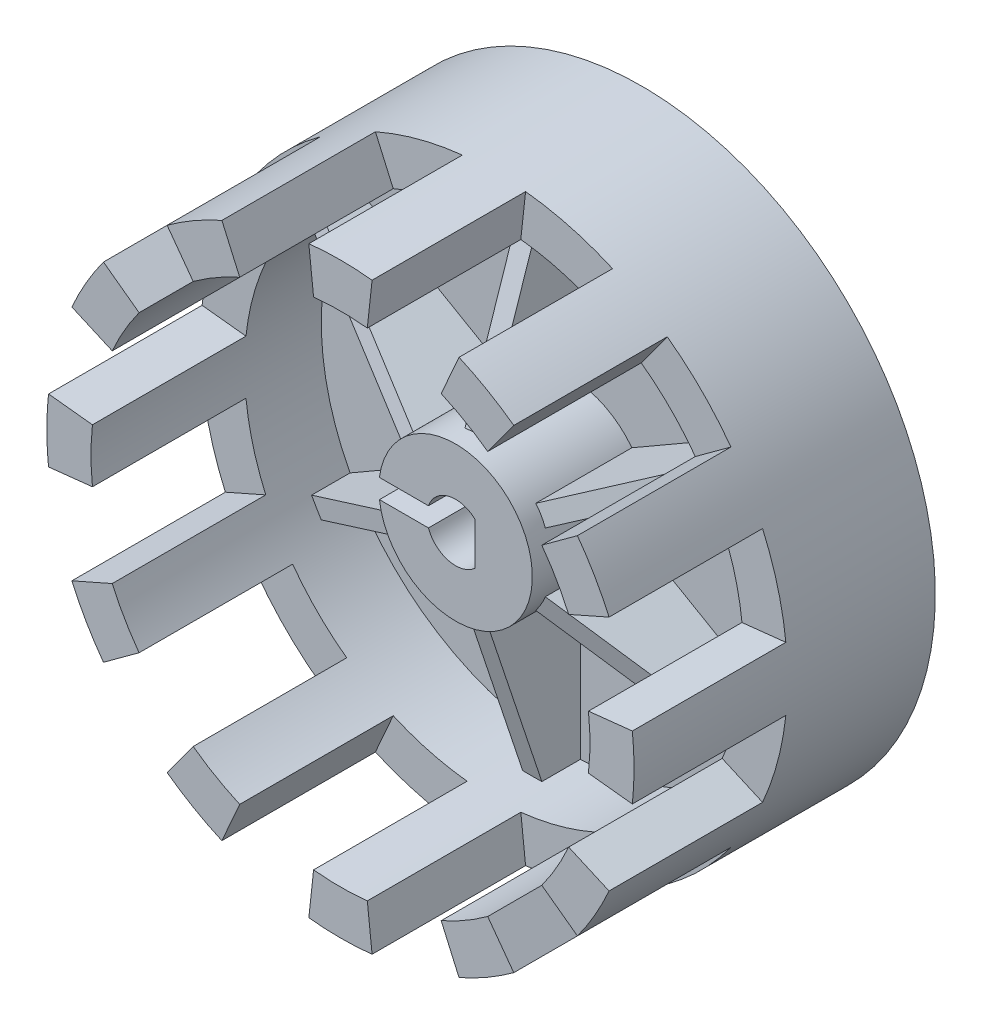
from build123d import *
from build123d.topology import SkipClean

# Parameters (mm, degrees)
ESQUISSE1_R                  = 15.3
BOSS_EXTRU_1_DEPTH           = 3.5
ESQUISSE7_R                  = 15.3
ESQUISSE7_R_2                = 11
ESQUISSE7_R_3                = 3.5
BOSS_EXTRU_10_DEPTH          = 0.2
ESQUISSE2_R                  = 4
BOSS_EXTRU_2_DEPTH           = 6
ENL_V_MAT_EXTRU_2_DEPTH      = 24.631123545
ENL_V_MAT_EXTRU_2_DEPTH_BACK = 24.631123545
ESQUISSE4_R                  = 15.3
ESQUISSE4_R_2                = 13
BOSS_EXTRU_3_DEPTH           = 4
BOSS_EXTRU_4_DEPTH           = 8
R_P_TITION_CIRCULAIRE1_COUNT = 12
BOSS_EXTRU_9_DEPTH           = 0.5
R_P_TITION_CIRCULAIRE4_COUNT = 6


with BuildPart() as part:
    # Esquisse1 → Boss.-Extru.1 (new body)
    with BuildSketch(Plane.XY):
        Circle(ESQUISSE1_R)
    extrude(amount=BOSS_EXTRU_1_DEPTH)

    # Esquisse7 → Boss.-Extru.10 (add, symmetric)
    # profile 1 of 2: a face of its own
    with SkipClean():  # the faces are left unmerged after this step: merging them gives an invalid solid
        with BuildSketch(Plane(origin=(0, 0, 0), x_dir=(-1, 0, 0), z_dir=(0, 0, -1))):
            Circle(ESQUISSE7_R)
            Circle(ESQUISSE7_R_2, mode=Mode.SUBTRACT)
        # profile 2 of 2: a face of its own
        with BuildSketch(Plane(origin=(0, 0, 0), x_dir=(-1, 0, 0), z_dir=(0, 0, -1))):
            Circle(ESQUISSE7_R_3)
        extrude(amount=BOSS_EXTRU_10_DEPTH, both=True)

    # Esquisse2 → Boss.-Extru.2 (add)
    with SkipClean():  # the faces are left unmerged after this step: merging them gives an invalid solid
        with BuildSketch(Plane.XY.offset(3.5)):
            Circle(ESQUISSE2_R)
        extrude(amount=BOSS_EXTRU_2_DEPTH)

    # Esquisse3 → Enlèv. mat.-Extru.2 (cut, two sides: drawn at the far end of the back side and taken through both)
    with SkipClean():  # the faces are left unmerged after this step: merging them gives an invalid solid
        with BuildSketch(Plane.XY.offset(-ENL_V_MAT_EXTRU_2_DEPTH_BACK)):
            with BuildLine():
                Line((1, 1.118033989), (1, -1.118033989))
                ThreePointArc((1, -1.118033989), (-0.37200097, -1.4531398), (-1.414213562, -0.5))
                Line((-1.414213562, -0.5), (-8.414213562, -0.5))
                Line((-8.414213562, -0.5), (-8.414213562, 0.5))
                Line((-8.414213562, 0.5), (-1.414213562, 0.5))
                ThreePointArc((-1.414213562, 0.5), (-0.37200097, 1.4531398), (1, 1.118033989))
            make_face()
        extrude(amount=ENL_V_MAT_EXTRU_2_DEPTH + ENL_V_MAT_EXTRU_2_DEPTH_BACK, mode=Mode.SUBTRACT)

    # Esquisse4 → Boss.-Extru.3 (add)
    with SkipClean():  # the faces are left unmerged after this step: merging them gives an invalid solid
        with BuildSketch(Plane.XY.offset(3.5)):
            Circle(ESQUISSE4_R)
            Circle(ESQUISSE4_R_2, mode=Mode.SUBTRACT)
        extrude(amount=BOSS_EXTRU_3_DEPTH)

    # Esquisse5 → Boss.-Extru.4 (add)
    with SkipClean():  # the faces are left unmerged after this step: merging them gives an invalid solid
        with BuildSketch(Plane.XY.offset(7.5)):
            with BuildLine():
                Line((-1.647692308, 15.211019363), (-1.4, 12.924395537))
                ThreePointArc((-1.4, 12.924395537), (0, 13), (1.4, 12.924395537))
                Line((1.4, 12.924395537), (1.647692308, 15.211019363))
                ThreePointArc((1.647692308, 15.211019363), (0, 15.3), (-1.647692308, 15.211019363))
            make_face()
        boss_extru_4 = extrude(amount=BOSS_EXTRU_4_DEPTH)

    # Répétition circulaire1: Boss.-Extru.4 ×12 about axis
    with SkipClean():  # the faces are left unmerged after this step: merging them gives an invalid solid
        r_p_tition_circulaire1_axis = Axis((0, 0, -0.775), (0, 0, 1))
        for i in range(1, R_P_TITION_CIRCULAIRE1_COUNT):
            add(boss_extru_4.rotate(r_p_tition_circulaire1_axis, i * 360 / R_P_TITION_CIRCULAIRE1_COUNT))

    # Esquisse6 → Boss.-Extru.9 (add, symmetric)
    with SkipClean():  # the faces are left unmerged after this step: merging them gives an invalid solid
        with BuildSketch(Plane(origin=(0, 0, 0), x_dir=(0, 0, 1), z_dir=(1, 0, 0))):
            Polygon((8.833333333, 3), (5.5, 13), (3.5, 13), (3.5, 3), align=None)
        boss_extru_9 = extrude(amount=BOSS_EXTRU_9_DEPTH, both=True)

    # Répétition circulaire4: Boss.-Extru.9 ×6 about axis
    with SkipClean():  # the faces are left unmerged after this step: merging them gives an invalid solid
        r_p_tition_circulaire4_axis = Axis((0, 0, -0.775), (0, 0, 1))
        for i in range(1, R_P_TITION_CIRCULAIRE4_COUNT):
            add(boss_extru_9.rotate(r_p_tition_circulaire4_axis, i * 360 / R_P_TITION_CIRCULAIRE4_COUNT))


solid = part.part
